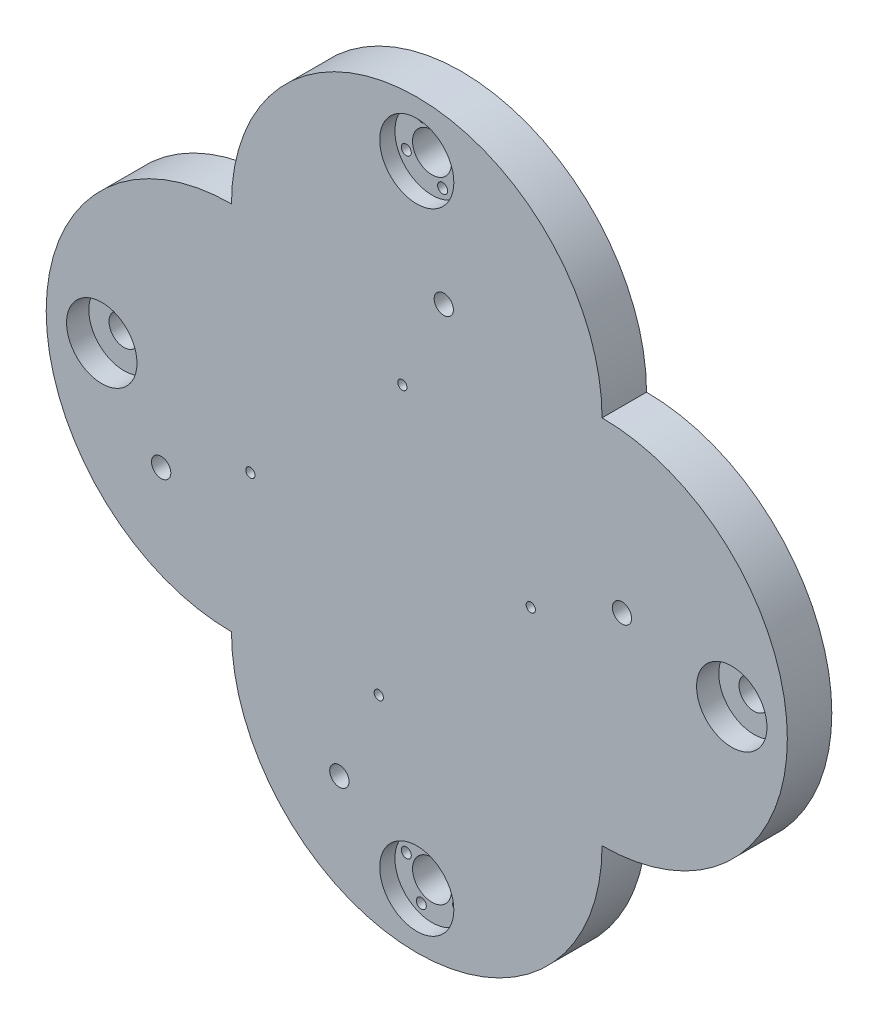
from build123d import *

# Parameters (mm, degrees)
IZIM1_R                     = 4
Y_KSEKLIK_EKSTR_ZYON1_DEPTH = 12
IZIM2_R                     = 1.25
KES_EKSTR_ZYON1_DEPTH       = 50
KES_EKSTR_ZYON2_START       = -4.1
IZIM3_R                     = 10
IZIM3_R_2                   = 4
KES_EKSTR_ZYON2_DEPTH       = 4.1
KES_EKSTR_ZYON3_START       = -10
IZIM4_R                     = 1.35
IZIM4_R_2                   = 5.25
IZIM4_R_3                   = 4
KES_EKSTR_ZYON3_DEPTH       = 10
IZIM5_R                     = 9.5
KES_EKSTR_ZYON4_DEPTH       = 50
Y_KSEKLIK_EKSTR_ZYON2_START = -6
IZIM6_R                     = 9.5
IZIM6_R_2                   = 4.05
Y_KSEKLIK_EKSTR_ZYON2_DEPTH = 6
IZIM7_R                     = 2.6
KES_EKSTR_ZYON5_DEPTH       = 50


with BuildPart() as part:
    # Çizim1 → Yükseklik-Ekstrüzyon1 (new body)
    # profile 1 of 4: a face of its own
    with BuildSketch(Plane.XY):
        with BuildLine():
            Line((-24.007220217, 9.566787004), (-74.007220217, 59.566787004))
            ThreePointArc((-74.007220217, 59.566787004), (-124.007220217, 9.566787004), (-74.007220217, -40.433212996))
            Line((-74.007220217, -40.433212996), (-24.007220217, 9.566787004))
        make_face()
        with Locations((-109.007220217, 9.566787004)):
            Circle(IZIM1_R, mode=Mode.SUBTRACT)
    # profile 2 of 4: a face of its own
    with BuildSketch(Plane.XY):
        with BuildLine():
            ThreePointArc((25.992779783, 59.566787004), (-24.007220217, 109.566787004), (-74.007220217, 59.566787004))
            Line((-74.007220217, 59.566787004), (-24.007220217, 9.566787004))
            Line((-24.007220217, 9.566787004), (25.992779783, 59.566787004))
        make_face()
        with Locations((-24.007220217, 94.566787004)):
            Circle(IZIM1_R, mode=Mode.SUBTRACT)
    # profile 3 of 4: a face of its own
    with BuildSketch(Plane.XY):
        with BuildLine():
            Line((25.992779783, 59.566787004), (-24.007220217, 9.566787004))
            Line((-24.007220217, 9.566787004), (25.992779783, -40.433212996))
            ThreePointArc((25.992779783, -40.433212996), (75.992779783, 9.566787004), (25.992779783, 59.566787004))
        make_face()
        with Locations((60.992779783, 9.566787004)):
            Circle(IZIM1_R, mode=Mode.SUBTRACT)
    # profile 4 of 4: a face of its own
    with BuildSketch(Plane.XY):
        with BuildLine():
            Line((25.992779783, -40.433212996), (-24.007220217, 9.566787004))
            Line((-24.007220217, 9.566787004), (-74.007220217, -40.433212996))
            ThreePointArc((-74.007220217, -40.433212996), (-24.007220217, -90.433212996), (25.992779783, -40.433212996))
        make_face()
        with Locations((-24.007220217, -75.433212996)):
            Circle(IZIM1_R, mode=Mode.SUBTRACT)
    extrude(amount=Y_KSEKLIK_EKSTR_ZYON1_DEPTH)

    # Çizim2 → Kes-Ekstrüzyon1 (cut)
    with BuildSketch(Plane.XY.offset(12)):
        with Locations((-27.895001347, 40.325931985)):
            Circle(IZIM2_R)
        with Locations((-68.907194656, -0.686261324)):
            Circle(IZIM2_R)
        with Locations((-34.258962377, -35.334493602)):
            Circle(IZIM2_R)
        with Locations((6.753230931, 5.677699707)):
            Circle(IZIM2_R)
    extrude(amount=-KES_EKSTR_ZYON1_DEPTH, mode=Mode.SUBTRACT)

    # Çizim3 → Kes-Ekstrüzyon2 (cut)
    # profile 1 of 2: a face of its own
    with BuildSketch(Plane.XY.offset(12).offset(KES_EKSTR_ZYON2_START)):
        with Locations((-24.007220217, -75.433212996)):
            Circle(IZIM3_R)
        with Locations((-24.007220217, -75.433212996)):
            Circle(IZIM3_R_2, mode=Mode.SUBTRACT)
    # profile 2 of 2: a face of its own
    with BuildSketch(Plane.XY.offset(12).offset(KES_EKSTR_ZYON2_START)):
        with Locations((-24.007220217, 94.566787004)):
            Circle(IZIM3_R)
    extrude(amount=KES_EKSTR_ZYON2_DEPTH, mode=Mode.SUBTRACT)

    # Çizim4 → Kes-Ekstrüzyon3 (cut)
    # profile 1 of 11: a face of its own
    with BuildSketch(Plane.XY.offset(7.9).offset(KES_EKSTR_ZYON3_START)):
        with Locations((-26.880087777, -82.361173156)):
            Circle(IZIM4_R)
    # profile 2 of 11: a face of its own
    with BuildSketch(Plane.XY.offset(7.9).offset(KES_EKSTR_ZYON3_START)):
        with Locations((-17.079260057, -78.306080557)):
            Circle(IZIM4_R)
    # profile 3 of 11: a face of its own
    with BuildSketch(Plane.XY.offset(7.9).offset(KES_EKSTR_ZYON3_START)):
        with Locations((-30.935180377, -72.560345436)):
            Circle(IZIM4_R)
    # profile 4 of 11: a face of its own
    with BuildSketch(Plane.XY.offset(7.9).offset(KES_EKSTR_ZYON3_START)):
        with Locations((-21.134352656, -68.505252836)):
            Circle(IZIM4_R)
    # profile 5 of 11: a face of its own
    with BuildSketch(Plane.XY.offset(7.9).offset(KES_EKSTR_ZYON3_START)):
        with Locations((-24.007220217, -75.433212996)):
            Circle(IZIM4_R_2)
    # profile 6 of 11: a face of its own
    with BuildSketch(Plane.XY.offset(7.9).offset(KES_EKSTR_ZYON3_START)):
        with Locations((-21.134352656, 87.638826844)):
            Circle(IZIM4_R)
    # profile 7 of 11: a face of its own
    with BuildSketch(Plane.XY.offset(7.9).offset(KES_EKSTR_ZYON3_START)):
        with Locations((-30.935180377, 91.693919443)):
            Circle(IZIM4_R)
    # profile 8 of 11: a face of its own
    with BuildSketch(Plane.XY.offset(7.9).offset(KES_EKSTR_ZYON3_START)):
        with Locations((-24.007220217, 94.566787004)):
            Circle(IZIM4_R_2)
        with Locations((-24.007220217, 94.566787004)):
            Circle(IZIM4_R_3, mode=Mode.SUBTRACT)
    # profile 9 of 11: a face of its own
    with BuildSketch(Plane.XY.offset(7.9).offset(KES_EKSTR_ZYON3_START)):
        with Locations((-24.007220217, 94.566787004)):
            Circle(IZIM4_R_3)
    # profile 10 of 11: a face of its own
    with BuildSketch(Plane.XY.offset(7.9).offset(KES_EKSTR_ZYON3_START)):
        with Locations((-26.880087777, 101.494747164)):
            Circle(IZIM4_R)
    # profile 11 of 11: a face of its own
    with BuildSketch(Plane.XY.offset(7.9).offset(KES_EKSTR_ZYON3_START)):
        with Locations((-17.079260057, 97.439654564)):
            Circle(IZIM4_R)
    extrude(amount=KES_EKSTR_ZYON3_DEPTH, mode=Mode.SUBTRACT)

    # Çizim5 → Kes-Ekstrüzyon4 (cut)
    with BuildSketch(Plane.XY.offset(12)):
        with Locations((-109.007220217, 9.566787004)):
            Circle(IZIM5_R)
        with Locations((60.992779783, 9.566787004)):
            Circle(IZIM5_R)
    extrude(amount=-KES_EKSTR_ZYON4_DEPTH, mode=Mode.SUBTRACT)

    # Çizim6 → Yükseklik-Ekstrüzyon2 (add)
    # profile 1 of 2: a face of its own
    with BuildSketch(Plane(origin=(0, 0, 0), x_dir=(-1, 0, 0), z_dir=(0, 0, -1)).offset(Y_KSEKLIK_EKSTR_ZYON2_START)):
        with Locations(Location((109.007220217, 9.566787004, 0), (0, 0, 180))):
            Circle(IZIM6_R)
        with Locations((109.007220217, 9.566787004)):
            Circle(IZIM6_R_2, mode=Mode.SUBTRACT)
    # profile 2 of 2: a face of its own
    with BuildSketch(Plane(origin=(0, 0, 0), x_dir=(-1, 0, 0), z_dir=(0, 0, -1)).offset(Y_KSEKLIK_EKSTR_ZYON2_START)):
        with Locations(Location((-60.992779783, 9.566787004, 0), (0, 0, 180))):
            Circle(IZIM6_R)
        with Locations((-60.992779783, 9.566787004)):
            Circle(IZIM6_R_2, mode=Mode.SUBTRACT)
    extrude(amount=Y_KSEKLIK_EKSTR_ZYON2_DEPTH)

    # Çizim7 → Kes-Ekstrüzyon5 (cut)
    with BuildSketch(Plane.XY.offset(12)):
        with Locations((-16.717107836, 64.762736523)):
            Circle(IZIM7_R)
        with Locations((31.366153285, 16.679475402)):
            Circle(IZIM7_R)
        with Locations((-92.980015992, -11.500171633)):
            Circle(IZIM7_R)
        with Locations((-44.896754872, -59.583432754)):
            Circle(IZIM7_R)
    extrude(amount=-KES_EKSTR_ZYON5_DEPTH, mode=Mode.SUBTRACT)


solid = part.part
